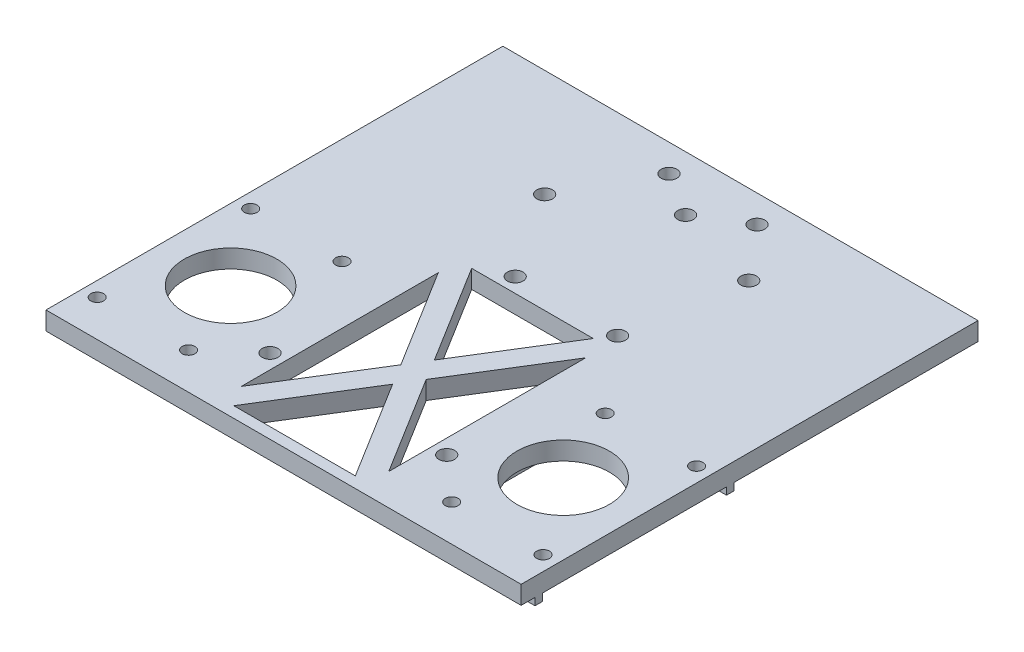
from build123d import *

# Parameters (mm, degrees)
SKETCH1_W           = 130
SKETCH1_H           = 125
BOSS_EXTRUDE1_DEPTH = 5
SKETCH2_R           = 1.75
SKETCH2_R_2         = 12.65
CUT_EXTRUDE1_DEPTH  = 10
SKETCH3_R           = 2.15
CUT_EXTRUDE2_DEPTH  = 10
SKETCH4_R           = 2.15
CUT_EXTRUDE3_DEPTH  = 10
BOSS_EXTRUDE2_DEPTH = 2
SKETCH6_R           = 2.65
CUT_EXTRUDE4_DEPTH  = 0.5
CUT_EXTRUDE5_DEPTH  = 91.311959341


with BuildPart() as part:
    # Sketch1 → Boss-Extrude1 (new body)
    with BuildSketch(Plane(origin=(0, 0, 0), x_dir=(1, 0, 0), z_dir=(0, 1, 0))):
        Rectangle(SKETCH1_W, SKETCH1_H)
    extrude(amount=BOSS_EXTRUDE1_DEPTH)

    # Sketch2 → Cut-Extrude1 (cut)
    with BuildSketch(Plane(origin=(0, 5, 0), x_dir=(1, 0, 0), z_dir=(0, 1, 0))):
        with Locations(Location((-61, -52.5, 0), (0, 0, 270))):
            Circle(SKETCH2_R)
        with Locations(Location((-36, -52.5, 0), (0, 0, 270))):
            Circle(SKETCH2_R)
        with Locations(Location((-36, -10.5, 0), (0, 0, 270))):
            Circle(SKETCH2_R)
        with Locations(Location((-61, -10.5, 0), (0, 0, 270))):
            Circle(SKETCH2_R)
        with Locations(Location((-45.5, -31.5, 0), (0, 0, 270))):
            Circle(SKETCH2_R_2)
    cut_extrude1 = extrude(amount=-CUT_EXTRUDE1_DEPTH, mode=Mode.SUBTRACT)

    # Mirror3: Cut-Extrude1 across plane
    add(cut_extrude1.mirror(Plane.ZY), mode=Mode.SUBTRACT)

    # Sketch3 → Cut-Extrude2 (cut)
    with BuildSketch(Plane(origin=(0, 5, 0), x_dir=(1, 0, 0), z_dir=(0, 1, 0))):
        with Locations(Location((-24.17, -42.03, 0), (0, 0, 270))):
            Circle(SKETCH3_R)
        with Locations(Location((24.17, -42.03, 0), (0, 0, 270))):
            Circle(SKETCH3_R)
        with Locations(Location((-8.73, 9.6, 0), (0, 0, 270))):
            Circle(SKETCH3_R)
        with Locations(Location((19.29, 9.6, 0), (0, 0, 270))):
            Circle(SKETCH3_R)
        with Locations(Location((-24.17, 33.11, 0), (0, 0, 270))):
            Circle(SKETCH3_R)
        with Locations(Location((24.17, 40.6, 0), (0, 0, 270))):
            Circle(SKETCH3_R)
    extrude(amount=-CUT_EXTRUDE2_DEPTH, mode=Mode.SUBTRACT)

    # Sketch4 → Cut-Extrude3 (cut)
    with BuildSketch(Plane(origin=(0, 5, 0), x_dir=(1, 0, 0), z_dir=(0, 1, 0))):
        with Locations(Location((0, 47.5, 0), (0, 0, 270))):
            Circle(SKETCH4_R)
        with Locations(Location((12.049810205, 55, 0), (0, 0, 270))):
            Circle(SKETCH4_R)
        with Locations(Location((-12.049810205, 55, 0), (0, 0, 270))):
            Circle(SKETCH4_R)
    extrude(amount=-CUT_EXTRUDE3_DEPTH, mode=Mode.SUBTRACT)

    # Sketch5 → Boss-Extrude2 (add)
    with BuildSketch(Plane.XZ):
        Polygon((-65, 58.7), (-65, 56.7), (-31.6, 56.7), (-31.6, 6.3), (-65, 6.3), (-65, 4.3), (-29.6, 4.3), (-29.6, 58.7), align=None)
    boss_extrude2 = extrude(amount=BOSS_EXTRUDE2_DEPTH)

    # Mirror5: Boss-Extrude2 across plane
    add(boss_extrude2.mirror(Plane.ZY))

    # Sketch6 → Cut-Extrude4 (cut)
    with BuildSketch(Plane.XZ):
        with Locations(Location((-12.049810205, -55, 0), (0, 0, 270))):
            Circle(SKETCH6_R)
        with Locations(Location((12.049810205, -55, 0), (0, 0, 270))):
            Circle(SKETCH6_R)
        with Locations(Location((0, -47.5, 0), (0, 0, 270))):
            Circle(SKETCH6_R)
        with Locations(Location((24.17, -40.6, 0), (0, 0, 270))):
            Circle(SKETCH6_R)
        with Locations(Location((-24.17, -33.11, 0), (0, 0, 270))):
            Circle(SKETCH6_R)
        with Locations(Location((-8.73, -9.6, 0), (0, 0, 270))):
            Circle(SKETCH6_R)
        with Locations(Location((19.29, -9.6, 0), (0, 0, 270))):
            Circle(SKETCH6_R)
        with Locations(Location((-61, 10.5, 0), (0, 0, 270))):
            Circle(SKETCH6_R)
        with Locations(Location((-61, 52.5, 0), (0, 0, 270))):
            Circle(SKETCH6_R)
        with Locations(Location((-36, 52.5, 0), (0, 0, 270))):
            Circle(SKETCH6_R)
        with Locations(Location((-36, 10.5, 0), (0, 0, 270))):
            Circle(SKETCH6_R)
        with Locations(Location((-24.17, 42.03, 0), (0, 0, 270))):
            Circle(SKETCH6_R)
        with Locations(Location((24.17, 42.03, 0), (0, 0, 270))):
            Circle(SKETCH6_R)
        with Locations(Location((36, 52.5, 0), (0, 0, 270))):
            Circle(SKETCH6_R)
        with Locations(Location((36, 10.5, 0), (0, 0, 270))):
            Circle(SKETCH6_R)
        with Locations(Location((61, 10.5, 0), (0, 0, 270))):
            Circle(SKETCH6_R)
        with Locations(Location((61, 52.5, 0), (0, 0, 270))):
            Circle(SKETCH6_R)
    extrude(amount=-CUT_EXTRUDE4_DEPTH, mode=Mode.SUBTRACT)

    # Sketch7 → Cut-Extrude5 (cut, through all)
    with BuildSketch(Plane.XZ):
        Polygon((-3.470107527, 26.95), (-20.17, 53.9), (-20.17, 0), align=None)
        Polygon((16.629937096, 59.5), (-16.629937096, 59.5), (0, 32.662892788), align=None)
        Polygon((20.17, 0), (20.17, 53.9), (3.470107527, 26.95), align=None)
        Polygon((0, 21.237107212), (-16.629937096, -5.6), (16.629937096, -5.6), align=None)
    extrude(amount=-CUT_EXTRUDE5_DEPTH, mode=Mode.SUBTRACT)


solid = part.part
